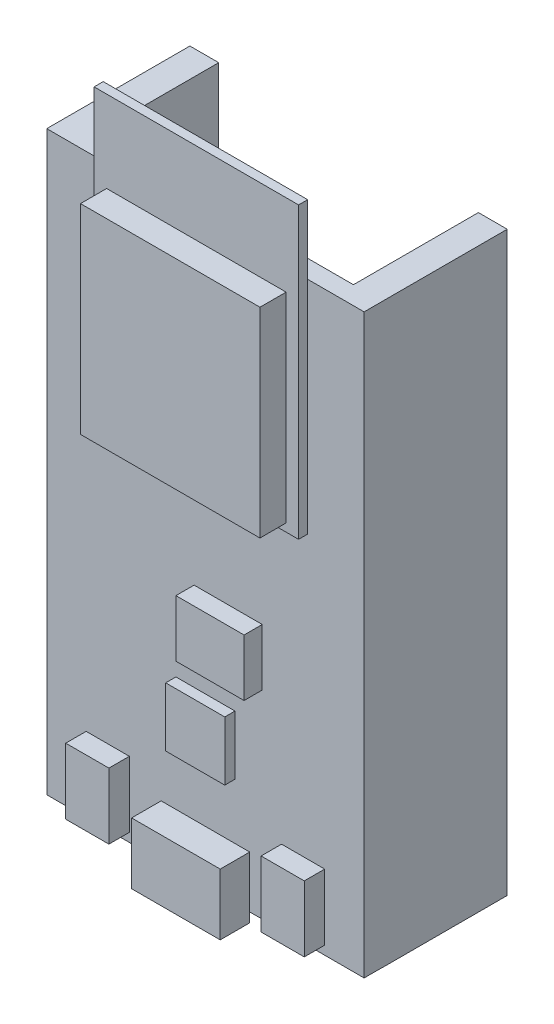
from build123d import *

# Parameters (mm, degrees)
SKETCH1_W            = 2.54
SKETCH1_H            = 50.8
BOSS_EXTRUDE1_DEPTH  = 8.5
SKETCH2_W            = 2.54
SKETCH2_H            = 50.8
BOSS_EXTRUDE2_DEPTH  = 2.5
SKETCH3_W            = 2.54
SKETCH3_H            = 50.8
BOSS_EXTRUDE3_DEPTH  = 8.5
SKETCH4_W            = 2.54
SKETCH4_H            = 50.8
BOSS_EXTRUDE4_DEPTH  = 2.5
SKETCH5_W            = 27.94
SKETCH5_H            = 50.79
BOSS_EXTRUDE5_DEPTH  = 1.6
SKETCH6_W            = 18
SKETCH6_H            = 25.5
BOSS_EXTRUDE6_DEPTH  = 0.8
SKETCH7_W            = 15.8
SKETCH7_H            = 17.6
BOSS_EXTRUDE7_DEPTH  = 2.3
SKETCH8_W            = 7.8
SKETCH8_H            = 5.4
BOSS_EXTRUDE8_DEPTH  = 2.6
SKETCH9_W            = 3.8
SKETCH9_H            = 5.8
BOSS_EXTRUDE9_DEPTH  = 1.8
SKETCH10_W           = 3.8
SKETCH10_H           = 5.8
BOSS_EXTRUDE10_DEPTH = 1.8
SKETCH11_W           = 5.2
SKETCH11_H           = 5.2
BOSS_EXTRUDE11_DEPTH = 0.9
SKETCH12_W           = 6
SKETCH12_H           = 5
BOSS_EXTRUDE12_DEPTH = 1.6


with BuildPart() as part:
    # Sketch1 → Boss-Extrude1 (new body)
    with BuildSketch(Plane.XY.offset(10.6)):
        with Locations((-29.7, 44.42)):
            Rectangle(SKETCH1_W, SKETCH1_H)
    extrude(amount=BOSS_EXTRUDE1_DEPTH)

    # Sketch2 → Boss-Extrude2 (add)
    with BuildSketch(Plane.XY.offset(19.1)):
        with Locations((-29.7, 44.42)):
            Rectangle(SKETCH2_W, SKETCH2_H)
    extrude(amount=BOSS_EXTRUDE2_DEPTH)



with BuildPart() as body_2:
    # Sketch3 → Boss-Extrude3 (new body)
    with BuildSketch(Plane.XY.offset(10.6)):
        with Locations((-4.3, 44.42)):
            Rectangle(SKETCH3_W, SKETCH3_H)
    extrude(amount=BOSS_EXTRUDE3_DEPTH)

    # Sketch4 → Boss-Extrude4 (add)
    with BuildSketch(Plane.XY.offset(19.1)):
        with Locations((-4.3, 44.42)):
            Rectangle(SKETCH4_W, SKETCH4_H)
    extrude(amount=BOSS_EXTRUDE4_DEPTH)


with BuildPart() as part_1:
    add(part.part)

    add(body_2.part)  # Boss-Extrude5 merges body 2
    # Sketch5 → Boss-Extrude5 (add)
    with BuildSketch(Plane.XY.offset(21.6)):
        with Locations((-17, 44.425)):
            Rectangle(SKETCH5_W, SKETCH5_H)
    extrude(amount=BOSS_EXTRUDE5_DEPTH)

    # Sketch6 → Boss-Extrude6 (add)
    with BuildSketch(Plane.XY.offset(23.2)):
        with Locations((-17, 63.14)):
            Rectangle(SKETCH6_W, SKETCH6_H)
    extrude(amount=BOSS_EXTRUDE6_DEPTH)

    # Sketch7 → Boss-Extrude7 (add)
    with BuildSketch(Plane.XY.offset(24)):
        with Locations((-17, 59.89)):
            Rectangle(SKETCH7_W, SKETCH7_H)
    extrude(amount=BOSS_EXTRUDE7_DEPTH)

    # Sketch8 → Boss-Extrude8 (add)
    with BuildSketch(Plane.XY.offset(23.2)):
        with Locations((-17, 20.9)):
            Rectangle(SKETCH8_W, SKETCH8_H)
    extrude(amount=BOSS_EXTRUDE8_DEPTH)

    # Sketch9 → Boss-Extrude9 (add)
    with BuildSketch(Plane.XY.offset(23.2)):
        with Locations((-25.6, 22.7)):
            Rectangle(SKETCH9_W, SKETCH9_H)
    extrude(amount=BOSS_EXTRUDE9_DEPTH)

    # Sketch10 → Boss-Extrude10 (add)
    with BuildSketch(Plane.XY.offset(23.2)):
        with Locations((-8.4, 22.7)):
            Rectangle(SKETCH10_W, SKETCH10_H)
    extrude(amount=BOSS_EXTRUDE10_DEPTH)

    # Sketch11 → Boss-Extrude11 (add)
    with BuildSketch(Plane.XY.offset(23.2)):
        with Locations((-17, 31.1)):
            Rectangle(SKETCH11_W, SKETCH11_H)
    extrude(amount=BOSS_EXTRUDE11_DEPTH)

    # Sketch12 → Boss-Extrude12 (add)
    with BuildSketch(Plane.XY.offset(23.2)):
        with Locations((-15, 39)):
            Rectangle(SKETCH12_W, SKETCH12_H)
    extrude(amount=BOSS_EXTRUDE12_DEPTH)


solid = part_1.part
